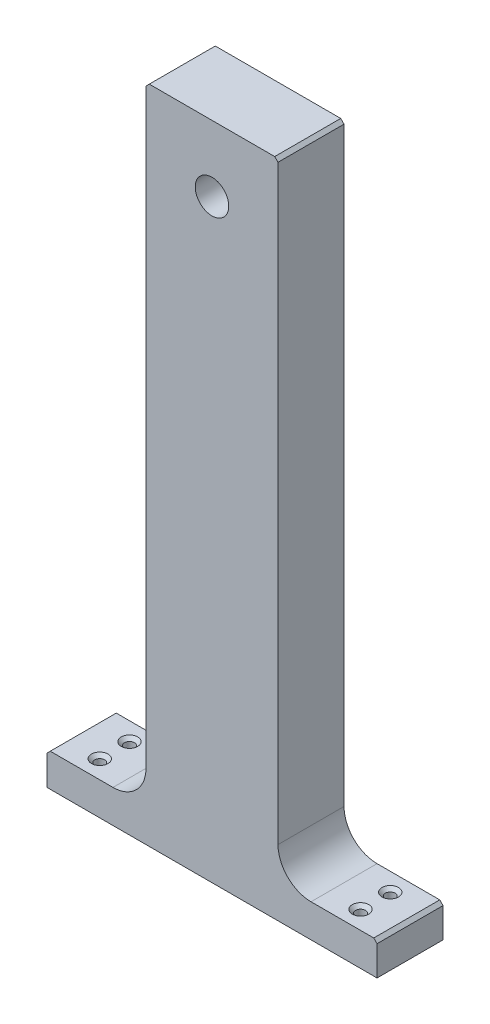
from build123d import *
from build123d.topology import SkipClean

# Parameters (mm, degrees)
BOSS_EXTRUDE2_DEPTH = 20
FILLET1_R           = 10
CHAMFER1_SIZE       = 1
SKETCH2_R           = 1.5
CUT_EXTRUDE1_DEPTH  = 20
CHAMFER3_SIZE       = 1


with BuildPart() as part:
    # Sketch1 → Boss-Extrude2 (new body)
    with BuildSketch(Plane.XY):
        with BuildLine():
            Line((138.685446009, 16.430118313), (158.685446009, 16.430118313))
            Line((158.685446009, 16.430118313), (188.685446009, 16.430118313))
            Line((188.685446009, 16.430118313), (188.685446009, 26.430118313))
            Line((188.685446009, 26.430118313), (158.685446009, 26.430118313))
            Line((158.685446009, 26.430118313), (158.685446009, 216.430118313))
            Line((158.685446009, 216.430118313), (138.685446009, 216.430118313))
            Line((138.685446009, 216.430118313), (138.685446009, 201.505118313))
            ThreePointArc((138.685446009, 201.505118313), (143.760446009, 196.430118313), (138.685446009, 191.355118313))
            Line((138.685446009, 191.355118313), (138.685446009, 16.430118313))
        make_face()
    extrude(amount=BOSS_EXTRUDE2_DEPTH)

    # Fillet1
    fillet1_edges = [part.edges().sort_by_distance(p)[0] for p in [
        (158.685446009, 26.430118313, 10),
    ]]
    fillet(fillet1_edges, radius=FILLET1_R)

    # Chamfer1
    chamfer1_edges = [part.edges().sort_by_distance(p)[0] for p in [
        (158.685446009, 216.430118313, 10),
        (188.685446009, 26.430118313, 10),
    ]]
    chamfer(chamfer1_edges, length=CHAMFER1_SIZE)

    # Sketch2 → Cut-Extrude1 (cut)
    with BuildSketch(Plane(origin=(0, 26.430118313, 0), x_dir=(1, 0, 0), z_dir=(0, 1, 0))):
        with Locations(Location((178.185446009, -5.5, 0), (0, 0, 270))):
            Circle(SKETCH2_R)
        with Locations(Location((178.185446009, -14.5, 0), (0, 0, 270))):
            Circle(SKETCH2_R)
    extrude(amount=-CUT_EXTRUDE1_DEPTH, mode=Mode.SUBTRACT)

    # Chamfer3
    chamfer3_edges = [part.edges().sort_by_distance(p)[0] for p in [
        (178.185446009, 26.430118313, 4),
        (178.185446009, 26.430118313, 13),
    ]]
    chamfer(chamfer3_edges, length=CHAMFER3_SIZE)

    # Mirror1: part across plane


with BuildPart() as part_1:
    with SkipClean():  # the faces are left unmerged after this step: merging them gives an invalid solid
        add(part.part)
        add(part.part.mirror(Plane(origin=(138.685446009, 16.430118313, 20), x_dir=(0, 0, 1), z_dir=(1, 0, 0))))


solid = part_1.part
